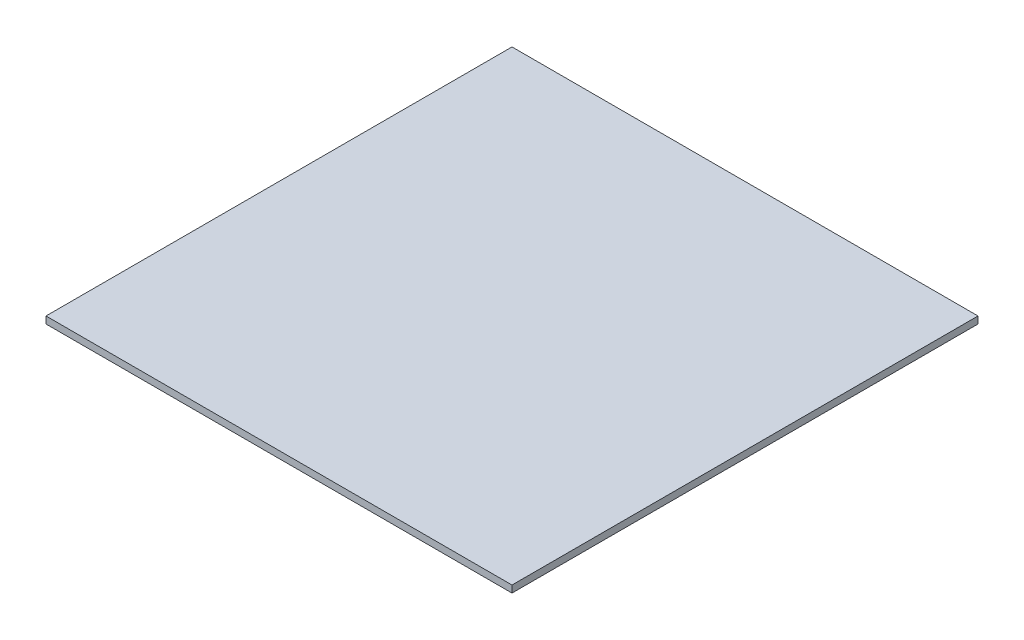
from build123d import *

# Parameters (mm, degrees)
SKETCH1_W           = 200
SKETCH1_H           = 200
BOSS_EXTRUDE1_DEPTH = 3


with BuildPart() as part:
    # Sketch1 → Boss-Extrude1 (new body)
    with BuildSketch(Plane(origin=(0, 0, 0), x_dir=(1, 0, 0), z_dir=(0, 1, 0))):
        Rectangle(SKETCH1_W, SKETCH1_H)
    extrude(amount=BOSS_EXTRUDE1_DEPTH)


solid = part.part
